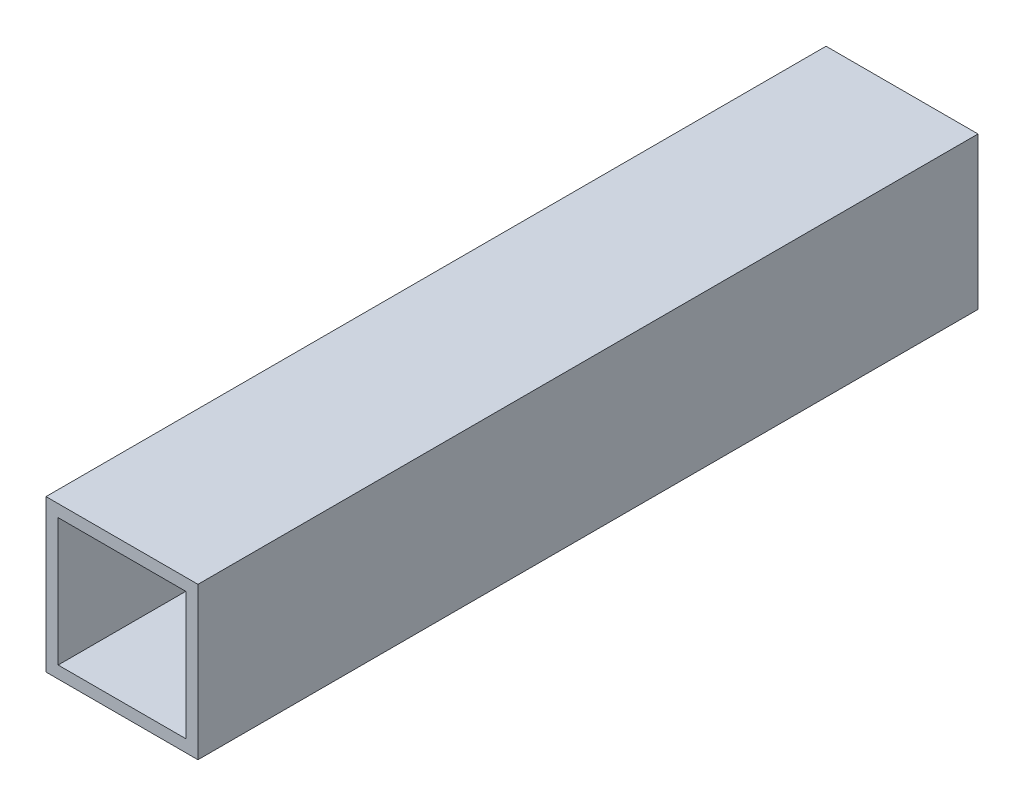
from build123d import *

# Parameters (mm, degrees)
SKETCH_1_W      = 15
SKETCH_1_H      = 15
SKETCH_1_W_2    = 12.6
SKETCH_1_H_2    = 12.6
EXTRUDE_1_DEPTH = 77


with BuildPart() as part:
    # 草图1 → 凸台-拉伸1 (new body)
    with BuildSketch(Plane.XY):
        Rectangle(SKETCH_1_W, SKETCH_1_H)
        Rectangle(SKETCH_1_W_2, SKETCH_1_H_2, mode=Mode.SUBTRACT)
    extrude(amount=EXTRUDE_1_DEPTH)


solid = part.part
